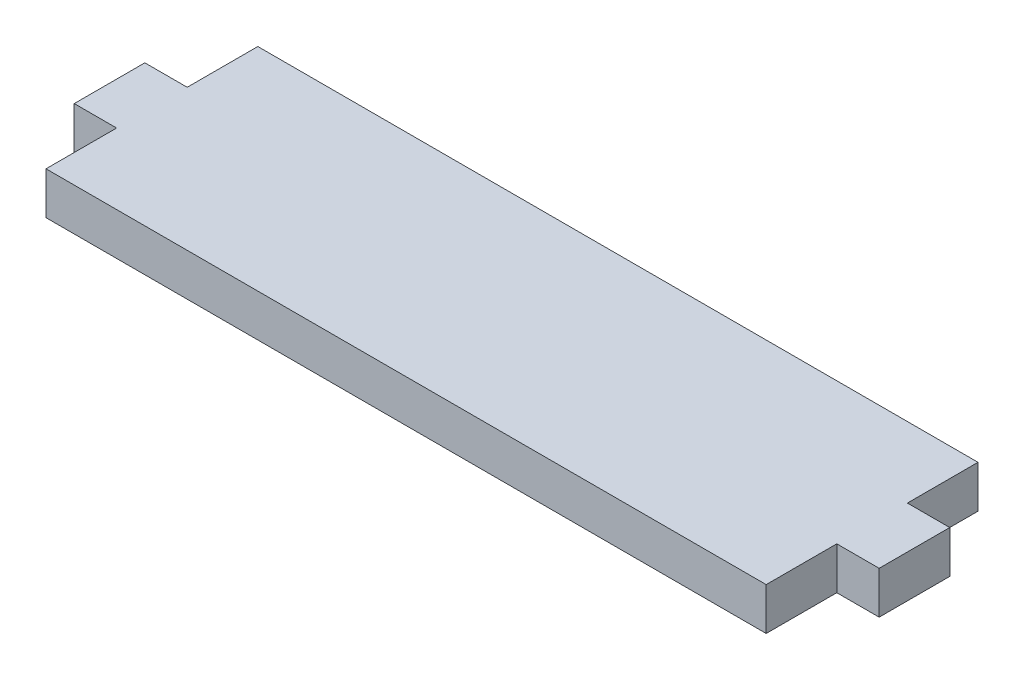
from build123d import *

# Parameters (mm, degrees)
BOSS_EXTRUDE1_DEPTH = 6


with BuildPart() as part:
    # Sketch1 → Boss-Extrude1 (new body)
    with BuildSketch(Plane(origin=(0, 0, 0), x_dir=(1, 0, 0), z_dir=(0, 1, 0))):
        Polygon((-54, -15), (48, -15), (48, -5), (54, -5), (54, 5), (48, 5), (48, 15), (-54, 15), (-54, 5), (-60, 5), (-60, -5), (-54, -5), align=None)
    extrude(amount=BOSS_EXTRUDE1_DEPTH)


solid = part.part
